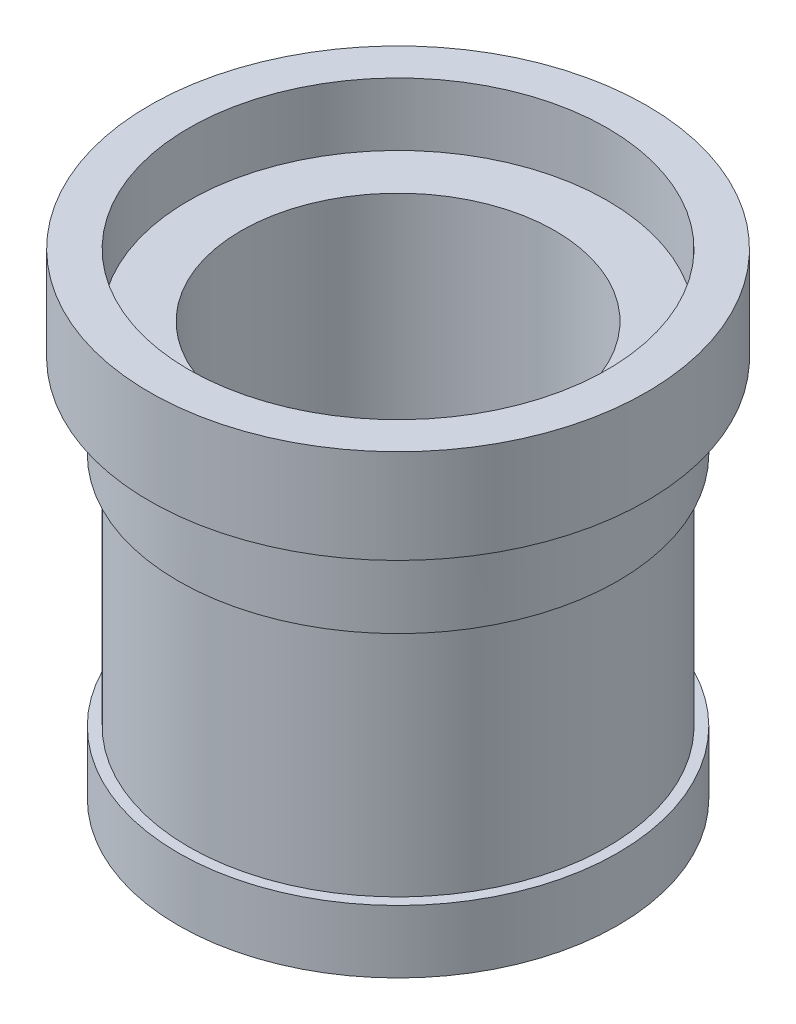
from build123d import *

# Parameters (mm, degrees)
SKETCH2_W          = 3
SKETCH2_H          = 10
CUT_EXTRUDE3_DEPTH = 5


with BuildPart() as part:
    # Sketch1 → Revolve1 (revolve)
    with BuildSketch(Plane.XY, mode=Mode.PRIVATE) as revolve1_sk:
        Polygon((30, -27.855726757), (30, 51.144273243), (40, 51.144273243), (40, 63.144273243), (47.5, 63.144273243), (47.5, 45.144273243), (42, 45.144273243), (42, 29.144273243), (40, 29.144273243), (40, -15.855726757), (42, -15.855726757), (42, -27.855726757), align=None)
    revolve(revolve1_sk.sketch.rotate(Axis((0, -44.504269507, 0), (0, 1, 0)), 90), axis=Axis((0, -44.504269507, 0), (0, 1, 0)))

    # Sketch2 → Cut-Extrude3 (cut, symmetric)
    with BuildSketch(Plane.XY):
        with Locations((-40.5, 40.144273243)):
            Rectangle(SKETCH2_W, SKETCH2_H)
    extrude(amount=CUT_EXTRUDE3_DEPTH, both=True, mode=Mode.SUBTRACT)


solid = part.part
